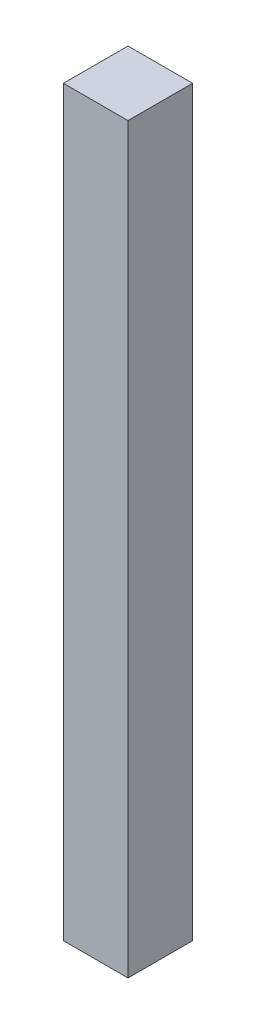
from build123d import *

# Parameters (mm, degrees)
SKETCH1_W           = 50
SKETCH1_H           = 575
BOSS_EXTRUDE1_DEPTH = 50


with BuildPart() as part:
    # Sketch1 → Boss-Extrude1 (new body)
    with BuildSketch(Plane(origin=(0, 0, 0), x_dir=(0, 0, -1), z_dir=(1, 0, 0))):
        Rectangle(SKETCH1_W, SKETCH1_H)
    extrude(amount=BOSS_EXTRUDE1_DEPTH)


solid = part.part
